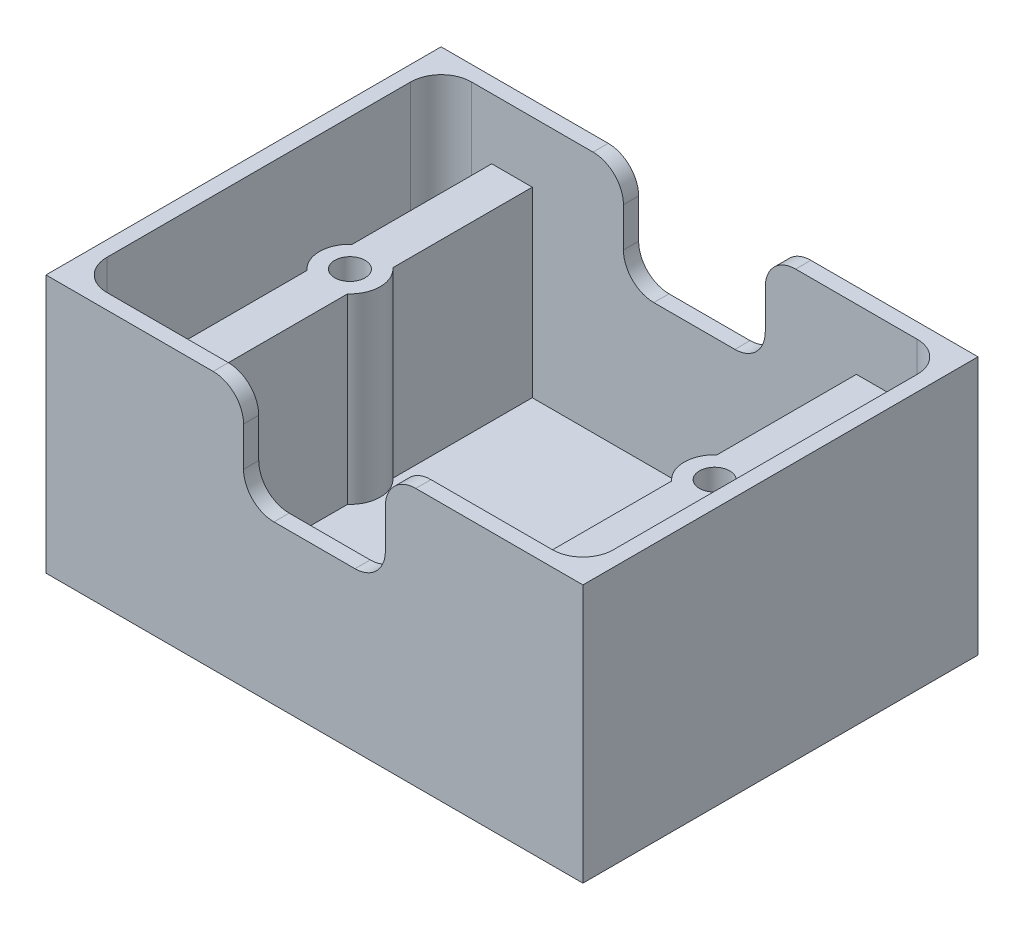
from build123d import *

# Parameters (mm, degrees)
SKETCH1_W           = 50
SKETCH1_H           = 36
BOSS_EXTRUDE1_DEPTH = 24
SHELL1_T            = 1.5
SKETCH2_W           = 4
SKETCH2_H           = 36
BOSS_EXTRUDE2_DEPTH = 18
SKETCH6_W           = 14
SKETCH6_H           = 14
CUT_EXTRUDE2_DEPTH  = 58
FILLET1_R           = 3
SKETCH4_R           = 3
BOSS_EXTRUDE3_DEPTH = 18
SKETCH7_R           = 1.5
CUT_EXTRUDE3_DEPTH  = 5


with BuildPart() as part:
    # Sketch1 → Boss-Extrude1 (new body)
    with BuildSketch(Plane(origin=(0, 0, 0), x_dir=(1, 0, 0), z_dir=(0, 1, 0))):
        with Locations((25, -18)):
            Rectangle(SKETCH1_W, SKETCH1_H)
    extrude(amount=BOSS_EXTRUDE1_DEPTH)

    # Shell1
    shell1_openings = [part.faces().sort_by_distance(p)[0] for p in [
        (25, 24, 18),
    ]]
    offset(amount=SHELL1_T, openings=shell1_openings, kind=Kind.INTERSECTION)

    # Sketch2 → Boss-Extrude2 (add)
    with BuildSketch(Plane(origin=(0, 0, 0), x_dir=(1, 0, 0), z_dir=(0, 1, 0))):
        with Locations((7, -18)):
            Rectangle(SKETCH2_W, SKETCH2_H)
        with Locations((43, -18)):
            Rectangle(SKETCH2_W, SKETCH2_H)
    extrude(amount=BOSS_EXTRUDE2_DEPTH)

    # Sketch6 → Cut-Extrude2 (cut)
    with BuildSketch(Plane.XY.offset(37.5)):
        with Locations((25, 21.134691447)):
            Rectangle(SKETCH6_W, SKETCH6_H)
    extrude(amount=-CUT_EXTRUDE2_DEPTH, mode=Mode.SUBTRACT)

    # Fillet1
    fillet1_edges = [part.edges().sort_by_distance(p)[0] for p in [
        (0, 12, 0),
        (0, 12, 36),
        (50, 12, 36),
        (50, 12, 0),
        (32, 24, -0.75),
        (32, 24, 36.75),
        (18, 24, 36.75),
        (18, 24, -0.75),
        (32, 14.134691447, 36.75),
        (32, 14.134691447, -0.75),
        (18, 14.134691447, -0.75),
        (18, 14.134691447, 36.75),
    ]]
    fillet(fillet1_edges, radius=FILLET1_R)

    # Sketch4 → Boss-Extrude3 (add)
    with BuildSketch(Plane(origin=(0, 18, 0), x_dir=(1, 0, 0), z_dir=(0, 1, 0))):
        with Locations((7, -16)):
            Circle(SKETCH4_R)
        with Locations((43, -16)):
            Circle(SKETCH4_R)
    extrude(amount=-BOSS_EXTRUDE3_DEPTH)

    # Sketch7 → Cut-Extrude3 (cut)
    with BuildSketch(Plane(origin=(0, 18, 0), x_dir=(1, 0, 0), z_dir=(0, 1, 0))):
        with Locations(Location((7, -16, 0), (0, 0, 270))):
            Circle(SKETCH7_R)
        with Locations(Location((43, -16, 0), (0, 0, 90))):
            Circle(SKETCH7_R)
    extrude(amount=-CUT_EXTRUDE3_DEPTH, mode=Mode.SUBTRACT)


solid = part.part
